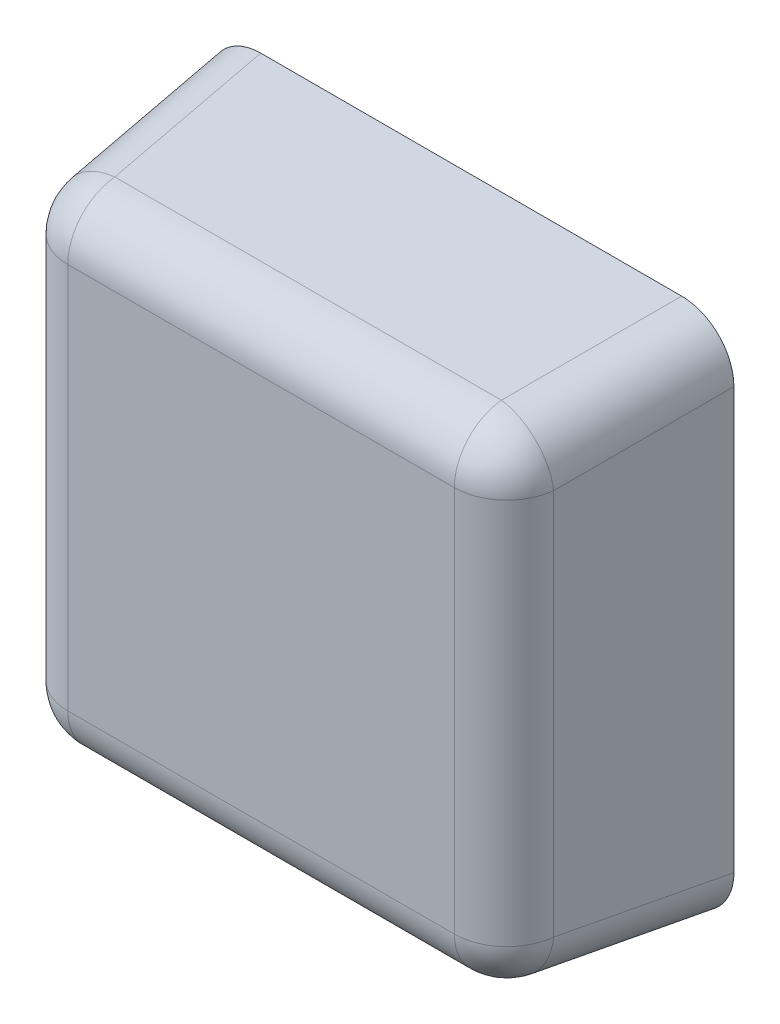
from build123d import *

# Parameters (mm, degrees)
SKETCH1_W           = 12.7
SKETCH1_H           = 12.7
BOSS_EXTRUDE1_DEPTH = 5.08
BOSS_EXTRUDE1_TAPER = 6
FILLET1_R           = 1.27


with BuildPart() as part:
    # Sketch1 → Boss-Extrude1 (new body)
    with BuildSketch(Plane.XY):
        with Locations((6.35, -6.35)):
            Rectangle(SKETCH1_W, SKETCH1_H)
    extrude(amount=BOSS_EXTRUDE1_DEPTH, taper=BOSS_EXTRUDE1_TAPER)

    # Fillet1
    fillet1_edges = [part.edges().sort_by_distance(p)[0] for p in [
        (12.166070485, -6.35, 5.08),
        (6.35, -0.533929515, 5.08),
        (0.533929515, -6.35, 5.08),
        (0.266964758, -0.266964758, 2.54),
        (12.43303478, -0.26696522, 2.540004395),
        (12.433035242, -12.433035242, 2.54),
        (0.26696522, -12.43303478, 2.540004395),
        (6.35, -12.166070485, 5.08),
    ]]
    fillet(fillet1_edges, radius=FILLET1_R)


solid = part.part
